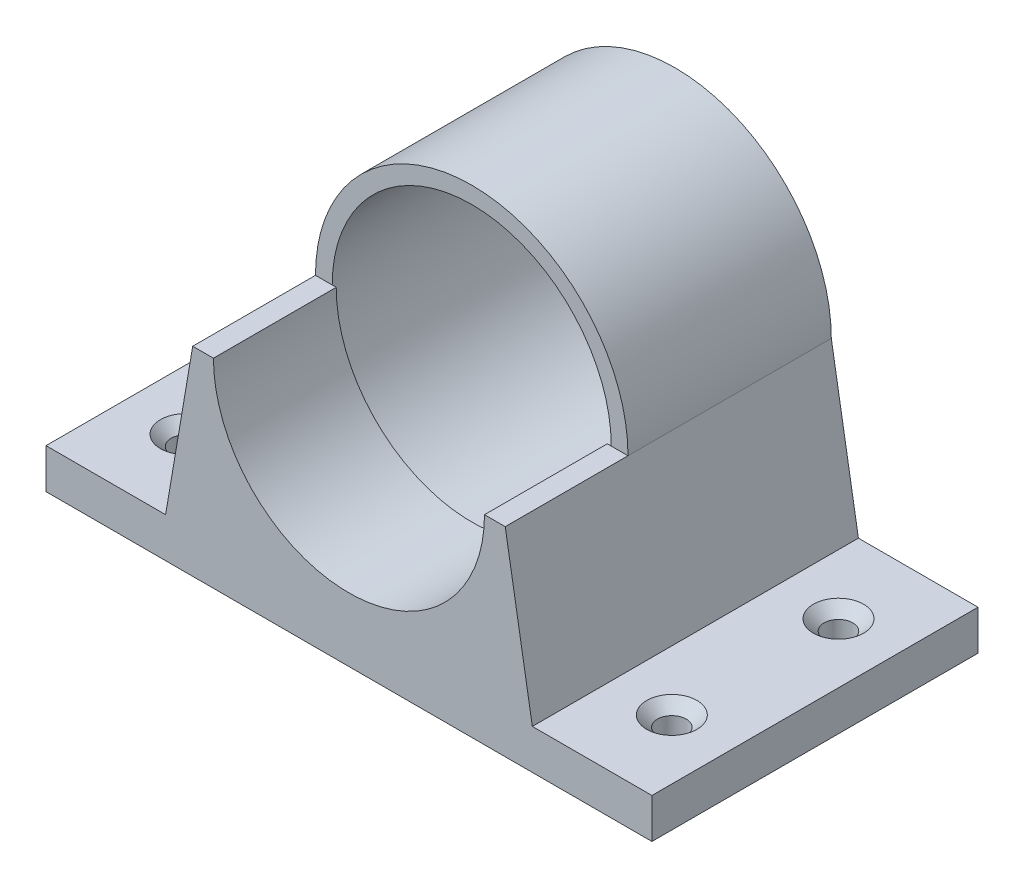
from build123d import *

# Parameters (mm, degrees)
SKETCH1_R                                       = 17.5
BOSS_EXTRUDE9_DEPTH                             = 25.5
BOSS_EXTRUDE10_DEPTH                            = 15.4
BOSS_EXTRUDE10_DEPTH_BACK                       = 25.5
CSK_FOR_M3_FLAT_HEAD_MACHINE_SCREW1_D           = 3.6
CSK_FOR_M3_FLAT_HEAD_MACHINE_SCREW1_CSINK_D     = 6.3
CSK_FOR_M3_FLAT_HEAD_MACHINE_SCREW1_CSINK_ANGLE = 90
CSK_FOR_M3_FLAT_HEAD_MACHINE_SCREW2_D           = 3.6
CSK_FOR_M3_FLAT_HEAD_MACHINE_SCREW2_CSINK_D     = 6.3
CSK_FOR_M3_FLAT_HEAD_MACHINE_SCREW2_CSINK_ANGLE = 90
BOSS_EXTRUDE11_DEPTH                            = 15.4
CUT_EXTRUDE3_REACH                              = 549.129
SKETCH17_R                                      = 1.8


with BuildPart() as part:
    # Sketch1 → Boss-Extrude9 (new body)
    with BuildSketch(Plane.XY):
        with BuildLine():
            ThreePointArc((-19.6, 18.153395679), (0, 37.753395679), (19.6, 18.153395679))
            ThreePointArc((19.6, 18.153395679), (0, -1.446604321), (-19.6, 18.153395679))
        make_face()
        with Locations((0, 18.153395679)):
            Circle(SKETCH1_R, mode=Mode.SUBTRACT)
    extrude(amount=-BOSS_EXTRUDE9_DEPTH)

    # Sketch1<15> → Boss-Extrude10 (add, two sides: drawn at the far end of the back side and taken through both)
    with BuildSketch(Plane.XY.offset(-BOSS_EXTRUDE10_DEPTH_BACK)):
        with BuildLine():
            Line((-23, -1.846604321), (-38, -1.846604321))
            Line((-38, -1.846604321), (-38, -6.846604321))
            Line((-38, -6.846604321), (38, -6.846604321))
            Line((38, -6.846604321), (38, -1.846604321))
            Line((38, -1.846604321), (23, -1.846604321))
            Line((23, -1.846604321), (19.6, 18.153395679))
            ThreePointArc((19.6, 18.153395679), (0, -1.446604321), (-19.6, 18.153395679))
            Line((-19.6, 18.153395679), (-23, -1.846604321))
        make_face()
    extrude(amount=BOSS_EXTRUDE10_DEPTH + BOSS_EXTRUDE10_DEPTH_BACK)

    # CSK for M3 Flat Head Machine Screw1 (through all)
    with Locations(Plane(origin=(0, -1.846604321, 0), x_dir=(1, 0, 0), z_dir=(0, 1, 0))):
        with Locations((-30.5, 15.5), (-30.5, -5.4)):
            CounterSinkHole(CSK_FOR_M3_FLAT_HEAD_MACHINE_SCREW1_D / 2, CSK_FOR_M3_FLAT_HEAD_MACHINE_SCREW1_CSINK_D / 2, counter_sink_angle=CSK_FOR_M3_FLAT_HEAD_MACHINE_SCREW1_CSINK_ANGLE)

    # CSK for M3 Flat Head Machine Screw2 (through all)
    with Locations(Plane(origin=(0, -1.846604321, 0), x_dir=(1, 0, 0), z_dir=(0, 1, 0))):
        with Locations((30.5, -5.4), (30.5, 15.5)):
            CounterSinkHole(CSK_FOR_M3_FLAT_HEAD_MACHINE_SCREW2_D / 2, CSK_FOR_M3_FLAT_HEAD_MACHINE_SCREW2_CSINK_D / 2, counter_sink_angle=CSK_FOR_M3_FLAT_HEAD_MACHINE_SCREW2_CSINK_ANGLE)

    # Sketch1<19> → Boss-Extrude11 (add)
    with BuildSketch(Plane.XY):
        with BuildLine():
            ThreePointArc((-19.6, 18.153395679), (0, -1.446604321), (19.6, 18.153395679))
            Line((19.6, 18.153395679), (17, 18.153395679))
            ThreePointArc((17, 18.153395679), (0, 1.153395679), (-17, 18.153395679))
            Line((-17, 18.153395679), (-19.6, 18.153395679))
        make_face()
    extrude(amount=BOSS_EXTRUDE11_DEPTH)

    # Sketch17 → Cut-Extrude3 (cut, up to next)
    with BuildSketch(Plane(origin=(-499.24894984, 9.974554812, -84.308871479), x_dir=(0.050830850863694654, -0.0009181581696580717, 0.9987068546806156), z_dir=(0.0360908865319125, 0.9993480899541042, -0.0009181581696581681)), mode=Mode.PRIVATE) as cut_extrude3_sk1:
        with Locations((92.5, 462.5)):
            Circle(SKETCH17_R)
    cut_extrude3_tool1 = extrude(cut_extrude3_sk1.sketch, amount=-CUT_EXTRUDE3_REACH, mode=Mode.PRIVATE) & part.part
    # Sketch17 → Cut-Extrude3 (cut, up to next)
    with BuildSketch(Plane(origin=(-499.24894984, 9.974554812, -84.308871479), x_dir=(0.050830850863694654, -0.0009181581696580717, 0.9987068546806156), z_dir=(0.0360908865319125, 0.9993480899541042, -0.0009181581696581681)), mode=Mode.PRIVATE) as cut_extrude3_sk2:
        with Locations((113.4, 462.5)):
            Circle(SKETCH17_R)
    cut_extrude3_tool2 = extrude(cut_extrude3_sk2.sketch, amount=-CUT_EXTRUDE3_REACH, mode=Mode.PRIVATE) & part.part
    add(cut_extrude3_tool1.solids().sort_by_distance((-32.946684, -6.80241, -15.437756))[0], mode=Mode.SUBTRACT)
    add(cut_extrude3_tool2.solids().sort_by_distance((-31.884319, -6.821599, 5.435217))[0], mode=Mode.SUBTRACT)


solid = part.part
